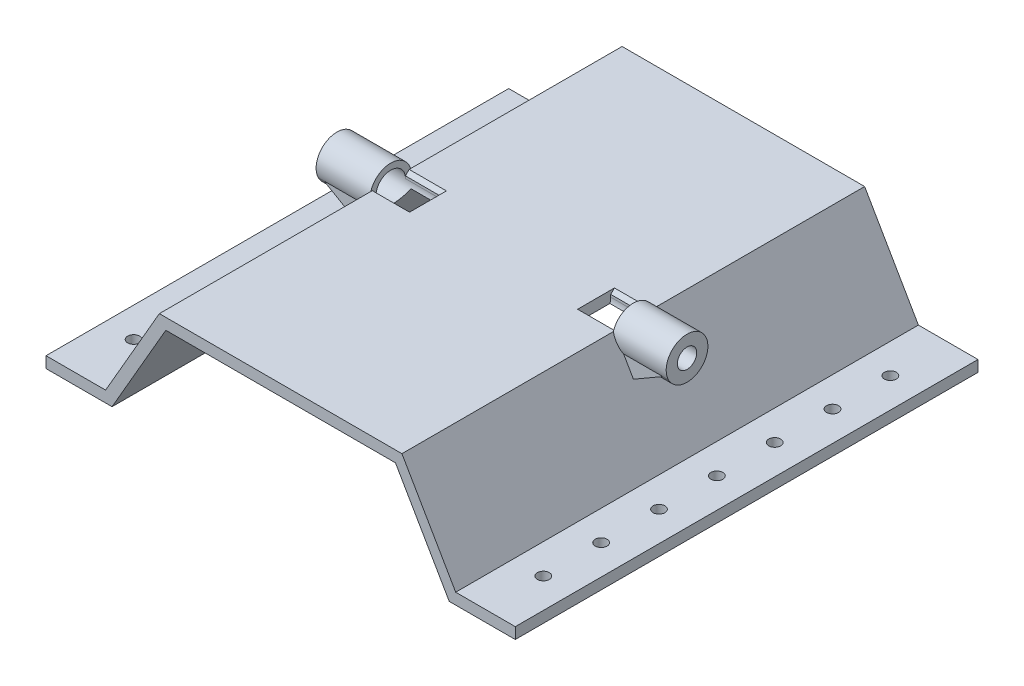
from build123d import *

# Parameters (mm, degrees)
EXTRUDE_1_DEPTH          = 62.115
EXTRUDE_START            = -62.995
SKETCH_2_W               = 10
SKETCH_2_H               = 28
EXTRUDE_2_DEPTH          = 62.995
CUT_EXTRUDE_1_DEPTH      = 10
SKETCH_4_R               = 1.6
CUT_EXTRUDE_2_DEPTH      = 3
CUT_EXTRUDE_3_DEPTH      = 10
SKETCH_6_R               = 5.6
SKETCH_6_R_2             = 2.6
EXTRUDE_3_DEPTH          = 14.433757
CUT_EXTRUDE_4_DEPTH      = 20
CUT_EXTRUDE_5_DEPTH      = 10
CUT_EXTRUDE_5_DEPTH_BACK = 8
SKETCH_7_R               = 3.95
CUT_EXTRUDE_START        = 10
CUT_EXTRUDE_6_DEPTH      = 10
CHAMFER_1_SIZE           = 1
CUT_EXTRUDE_7_DEPTH      = 10
CUT_EXTRUDE_8_DEPTH      = 143.906491892
EXTRUDE_START_2          = 1.73
SKETCH_10_R              = 2.6
EXTRUDE_4_DEPTH          = 1.73


with BuildPart() as part:
    # Эскиз1 → Бобышка-Вытянуть1 (new, symmetric)
    with BuildSketch(Plane.XY):
        Polygon((-62.995, 0), (-45.262949192, 0), (-30.829192463, 25), (0, 25), (0, 28), (-32.56124327, 28), (-46.995, 3), (-62.995, 3), align=None)
    extrude(amount=EXTRUDE_1_DEPTH, both=True)

    # Эскиз2 → Бобышка-Вытянуть2 (add)
    with BuildSketch(Plane(origin=(0, 0, 0), x_dir=(0, 0, -1), z_dir=(1, 0, 0)).offset(EXTRUDE_START)):
        with Locations((0, 14)):
            Rectangle(SKETCH_2_W, SKETCH_2_H)
    extrude(amount=EXTRUDE_2_DEPTH)

    # Эскиз3 → Вырез-Вытянуть1 (cut)
    with BuildSketch(Plane.XY.offset(5)):
        Polygon((0, 25), (0, 0), (-45.262949192, 0), (-30.829192463, 25), align=None)
    extrude(amount=-CUT_EXTRUDE_1_DEPTH, mode=Mode.SUBTRACT)

    # Эскиз4 → Вырез-Вытянуть2 (cut)
    with BuildSketch(Plane.XZ):
        with Locations(Location((-54.995, 0, 0), (0, 0, 270))):
            Circle(SKETCH_4_R)
        with Locations(Location((-54.995, -15.52875, 0), (0, 0, 270))):
            Circle(SKETCH_4_R)
        with Locations(Location((-54.995, -31.0575, 0), (0, 0, 270))):
            Circle(SKETCH_4_R)
        with Locations(Location((-54.995, -46.58625, 0), (0, 0, 270))):
            Circle(SKETCH_4_R)
        with Locations(Location((-54.995, 46.58625, 0), (0, 0, 90))):
            Circle(SKETCH_4_R)
        with Locations(Location((-54.995, 31.0575, 0), (0, 0, 90))):
            Circle(SKETCH_4_R)
        with Locations(Location((-54.995, 15.52875, 0), (0, 0, 90))):
            Circle(SKETCH_4_R)
    extrude(amount=-CUT_EXTRUDE_2_DEPTH, mode=Mode.SUBTRACT)

    # Эскиз5 → Вырез-Вытянуть3 (cut)
    with BuildSketch(Plane(origin=(0, 0, -5), x_dir=(-1, 0, 0), z_dir=(0, 0, -1))):
        Polygon((46.995, 3), (62.995, 3), (62.995, 28), (46.995, 28), (46.995, 24.7), (37.598624369, 19.275), align=None)
    extrude(amount=-CUT_EXTRUDE_3_DEPTH, mode=Mode.SUBTRACT)

    # Эскиз6 → Бобышка-Вытянуть3 (add)
    with BuildSketch(Plane.ZY.offset(46.995)):
        with Locations((0, 26.35)):
            Circle(SKETCH_6_R)
        with Locations((0, 26.35)):
            Circle(SKETCH_6_R_2, mode=Mode.SUBTRACT)
    extrude(amount=-EXTRUDE_3_DEPTH)

    # Эскиз6<2> → Вырез-Вытянуть4 (cut)
    with BuildSketch(Plane.ZY.offset(46.995)):
        with BuildLine():
            Line((-2.00935313, 28), (0, 28))
            Line((0, 28), (2.00935313, 28))
            ThreePointArc((2.00935313, 28), (0, 28.95), (-2.00935313, 28))
        make_face()
        with BuildLine():
            Line((-2.00935313, 24.7), (0, 24.7))
            Line((0, 24.7), (0, 28))
            Line((0, 28), (-2.00935313, 28))
            ThreePointArc((-2.00935313, 28), (-2.6, 26.35), (-2.00935313, 24.7))
        make_face()
        with BuildLine():
            Line((0, 28), (0, 24.7))
            Line((0, 24.7), (2.00935313, 24.7))
            ThreePointArc((2.00935313, 24.7), (2.447888696, 25.473734668), (2.6, 26.35))
            ThreePointArc((2.6, 26.35), (2.447888696, 27.226265332), (2.00935313, 28))
            Line((2.00935313, 28), (0, 28))
        make_face()
        with BuildLine():
            Line((2.00935313, 24.7), (0, 24.7))
            Line((0, 24.7), (-2.00935313, 24.7))
            ThreePointArc((-2.00935313, 24.7), (0, 23.75), (2.00935313, 24.7))
        make_face()
    extrude(amount=-CUT_EXTRUDE_4_DEPTH, mode=Mode.SUBTRACT)

    # Эскиз7 → Вырез-Вытянуть5 (cut, two sides: drawn at the far end of the back side and taken through both)
    with BuildSketch(Plane(origin=(-32.56124327, 0, 0), x_dir=(0, 0, -1), z_dir=(1, 0, 0)).offset(-CUT_EXTRUDE_5_DEPTH_BACK)):
        with Locations(Location((0, 26.35, 0), (0, 0, 199.984879971))):
            Circle(SKETCH_7_R)
    extrude(amount=CUT_EXTRUDE_5_DEPTH + CUT_EXTRUDE_5_DEPTH_BACK, mode=Mode.SUBTRACT)

    # Эскиз8 → Вырез-Вытянуть6 (cut)
    with BuildSketch(Plane.ZY.offset(22.56124327).offset(CUT_EXTRUDE_START)):
        with BuildLine():
            Line((-3.95, 26.35), (-3.95, 28))
            Line((-3.95, 28), (3.95, 28))
            Line((3.95, 28), (3.95, 26.35))
            ThreePointArc((3.95, 26.35), (3.890081094, 25.664602977), (3.712142239, 25))
            Line((3.712142239, 25), (-3.712142239, 25))
            ThreePointArc((-3.712142239, 25), (-3.890081094, 25.664602977), (-3.95, 26.35))
        make_face()
    extrude(amount=-CUT_EXTRUDE_6_DEPTH, mode=Mode.SUBTRACT)

    # Фаска1
    chamfer_1_edges = [part.edges().sort_by_distance(p)[0] for p in [
        (-27.56124327, 28, 3.95),
        (-27.56124327, 28, -3.95),
    ]]
    chamfer(chamfer_1_edges, length=CHAMFER_1_SIZE)

    # Эскиз3<2> → Вырез-Вытянуть7 (cut)
    with BuildSketch(Plane.XY.offset(5)):
        Polygon((0, 25), (0, 0), (-45.262949192, 0), (-30.829192463, 25), align=None)
    extrude(amount=-CUT_EXTRUDE_7_DEPTH, mode=Mode.SUBTRACT)

    # Эскиз9 → Вырез-Вытянуть8 (cut, through all)
    with BuildSketch(Plane.XY.offset(62.115)):
        Polygon((-45.262949192, 6), (-45.262949192, 31.95), (-62.995, 31.95), (-62.995, 3), (-46.995, 3), align=None)
    extrude(amount=-CUT_EXTRUDE_8_DEPTH, mode=Mode.SUBTRACT)

    # Эскиз10 → Бобышка-Вытянуть4 (add)
    with BuildSketch(Plane.ZY.offset(45.262949192).offset(EXTRUDE_START_2)):
        with BuildLine():
            Line((-5, 23.828095957), (-4.93330518, 23.7))
            ThreePointArc((-4.93330518, 23.7), (0, 20.75), (4.93330518, 23.7))
            Line((4.93330518, 23.7), (5, 23.828095957))
            ThreePointArc((5, 23.828095957), (0, 31.95), (-5, 23.828095957))
        make_face()
        with Locations((0, 26.35)):
            Circle(SKETCH_10_R, mode=Mode.SUBTRACT)
    extrude(amount=-EXTRUDE_4_DEPTH)

    # Зеркальное отражение1: part across plane


with BuildPart() as part_1:
    add(part.part)
    add(part.part.mirror(Plane(origin=(0, 25, 62.115), x_dir=(0, 0, 1), z_dir=(-1, 0, 0))))


solid = part_1.part
